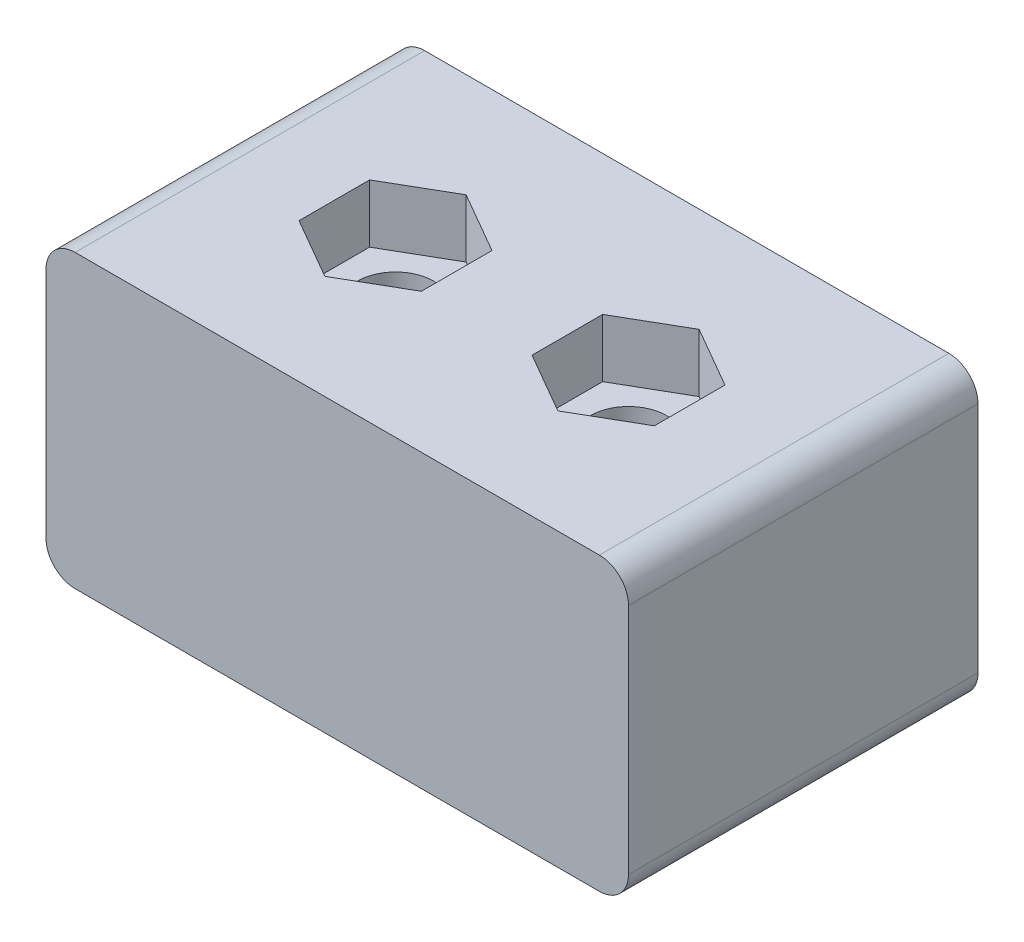
from build123d import *

# Parameters (mm, degrees)
BOSS_EXTRUDE1_DEPTH = 6
SKETCH2_R           = 1.3
CUT_EXTRUDE1_DEPTH  = 10
CUT_EXTRUDE2_DEPTH  = 2


with BuildPart() as part:
    # Sketch1 → Boss-Extrude1 (new, symmetric)
    with BuildSketch(Plane.XY):
        with BuildLine():
            Line((-9, 0), (9, 0))
            ThreePointArc((9, 0), (9.707106781, 0.292893219), (10, 1))
            Line((10, 1), (10, 9))
            ThreePointArc((10, 9), (9.707106781, 9.707106781), (9, 10))
            Line((9, 10), (-9, 10))
            ThreePointArc((-9, 10), (-9.707106781, 9.707106781), (-10, 9))
            Line((-10, 9), (-10, 1))
            ThreePointArc((-10, 1), (-9.707106781, 0.292893219), (-9, 0))
        make_face()
    extrude(amount=BOSS_EXTRUDE1_DEPTH, both=True)

    # Sketch2 → Cut-Extrude1 (cut)
    with BuildSketch(Plane(origin=(0, 0, 0), x_dir=(1, 0, 0), z_dir=(0, 1, 0))):
        with Locations(Location((4, 0, 0), (0, 0, 270))):
            Circle(SKETCH2_R)
        with Locations(Location((-4, 0, 0), (0, 0, 270))):
            Circle(SKETCH2_R)
    extrude(amount=CUT_EXTRUDE1_DEPTH, mode=Mode.SUBTRACT)

    # Sketch3 → Cut-Extrude2 (cut)
    with BuildSketch(Plane(origin=(0, 10, 0), x_dir=(1, 0, 0), z_dir=(0, 1, 0))):
        Polygon((6.1, -1.212435565), (4, -2.424871131), (1.9, -1.212435565), (1.9, 1.212435565), (4, 2.424871131), (6.1, 1.212435565), align=None)
        Polygon((-1.9, -1.212435565), (-4, -2.424871131), (-6.1, -1.212435565), (-6.1, 1.212435565), (-4, 2.424871131), (-1.9, 1.212435565), align=None)
    extrude(amount=-CUT_EXTRUDE2_DEPTH, mode=Mode.SUBTRACT)


solid = part.part
